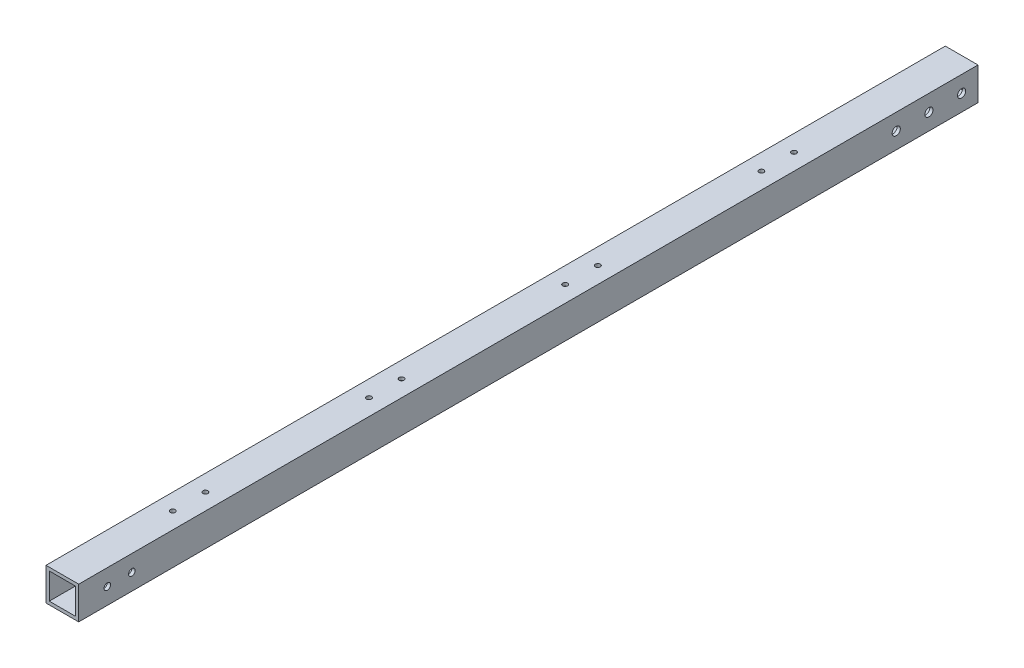
from build123d import *

# Parameters (mm, degrees)
SKETCH_1_W         = 20
SKETCH_1_H         = 20
SKETCH_1_W_2       = 16
SKETCH_1_H_2       = 16
EXTRUDE_1_DEPTH    = 550
SKETCH1_R          = 2
CUT_EXTRUDE1_DEPTH = 20
SKETCH2_R          = 2.5
CUT_EXTRUDE2_DEPTH = 20
SKETCH5_R          = 1.5
CUT_EXTRUDE3_DEPTH = 20


with BuildPart() as part:
    # 草图1 → 凸台-拉伸1 (new body)
    with BuildSketch(Plane.XY):
        Rectangle(SKETCH_1_W, SKETCH_1_H)
        Rectangle(SKETCH_1_W_2, SKETCH_1_H_2, mode=Mode.SUBTRACT)
    extrude(amount=EXTRUDE_1_DEPTH)

    # Sketch1 → Cut-Extrude1 (cut)
    with BuildSketch(Plane.ZY.offset(10)):
        with Locations((532.5, 0)):
            Circle(SKETCH1_R)
        with Locations((517.5, 0)):
            Circle(SKETCH1_R)
    extrude(amount=-CUT_EXTRUDE1_DEPTH, mode=Mode.SUBTRACT)

    # Sketch2 → Cut-Extrude2 (cut)
    with BuildSketch(Plane.ZY.offset(10)):
        with Locations((10, 0)):
            Circle(SKETCH2_R)
        with Locations((30, 0)):
            Circle(SKETCH2_R)
        with Locations((50, 0)):
            Circle(SKETCH2_R)
    extrude(amount=-CUT_EXTRUDE2_DEPTH, mode=Mode.SUBTRACT)

    # Sketch5 → Cut-Extrude3 (cut)
    with BuildSketch(Plane.XZ.offset(10)):
        with Locations(Location((0, 482.5, 0), (0, 0, 270))):
            Circle(SKETCH5_R)
        with Locations(Location((0, 462.5, 0), (0, 0, 270))):
            Circle(SKETCH5_R)
        with Locations(Location((0, 362.5, 0), (0, 0, 270))):
            Circle(SKETCH5_R)
        with Locations(Location((0, 342.5, 0), (0, 0, 270))):
            Circle(SKETCH5_R)
        with Locations(Location((0, 242.5, 0), (0, 0, 270))):
            Circle(SKETCH5_R)
        with Locations(Location((0, 222.5, 0), (0, 0, 270))):
            Circle(SKETCH5_R)
        with Locations(Location((0, 122.5, 0), (0, 0, 270))):
            Circle(SKETCH5_R)
        with Locations(Location((0, 102.5, 0), (0, 0, 270))):
            Circle(SKETCH5_R)
    extrude(amount=-CUT_EXTRUDE3_DEPTH, mode=Mode.SUBTRACT)


solid = part.part
